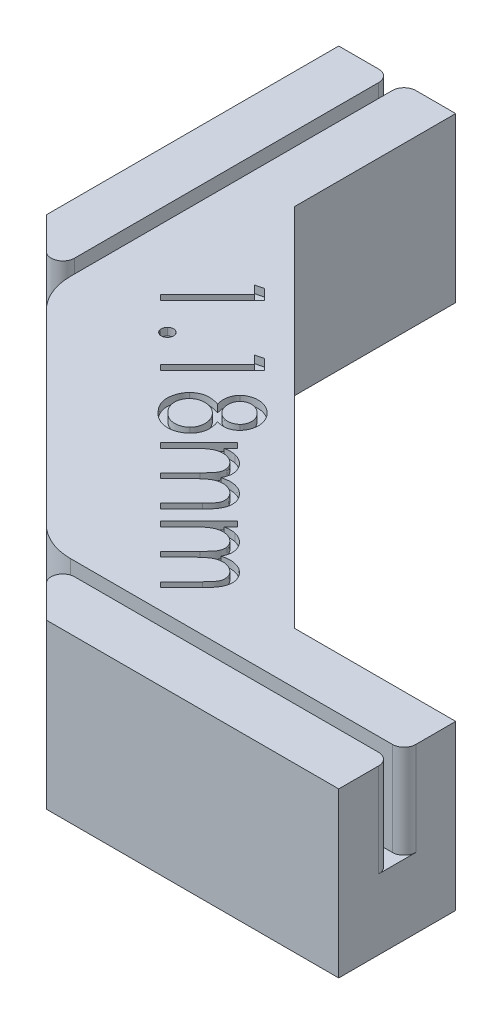
from build123d import *

# Parameters (mm, degrees)
BOSS_EXTRUDE1_DEPTH = 14
CUT_EXTRUDE1_DEPTH  = 8
CUT_EXTRUDE2_DEPTH  = 0.64
FILLET1_R           = 1
FILLET2_R           = 5


with BuildPart() as part:
    # Sketch1 → Boss-Extrude1 (new body)
    with BuildSketch(Plane(origin=(0, 0, 0), x_dir=(1, 0, 0), z_dir=(0, 1, 0))):
        Polygon((0, 30), (0, 55), (10, 55), (10, 41.213203436), (41.213203436, 10), (55, 10), (55, 0), (30, 0), align=None)
    extrude(amount=BOSS_EXTRUDE1_DEPTH)

    # Sketch2 → Cut-Extrude1 (cut)
    with BuildSketch(Plane(origin=(0, 14, 0), x_dir=(1, 0, 0), z_dir=(0, 1, 0))):
        Polygon((5.5875, 55), (5.5875, 5.5875), (55, 5.5875), (55, 4.4125), (4.4125, 4.4125), (4.4125, 55), align=None)
    extrude(amount=-CUT_EXTRUDE1_DEPTH, mode=Mode.SUBTRACT)

    # Sketch3 → Cut-Extrude2 (cut)
    # profile 1 of 6: a face of its own
    with BuildSketch(Plane(origin=(0, 14, 0), x_dir=(1, 0, 0), z_dir=(0, 1, 0))):
        Polygon((14.785653763, 33.874167542), (15.659541984, 33.000279321), (11.215050798, 28.555788135), (10.773654564, 28.997184369), (14.783109692, 33.006639498), (14.084762337, 33.704986853), align=None)
    # profile 2 of 6: a face of its own
    with BuildSketch(Plane(origin=(0, 14, 0), x_dir=(1, 0, 0), z_dir=(0, 1, 0))):
        with BuildLine():
            add(Edge.make_bspline(
                [(14.251767896, 26.849619916), (14.275302918, 26.823307617), (14.321148149, 26.772052367), (14.371597249, 26.681411104), (14.398423194, 26.582002855), (14.409202302, 26.477819656), (14.399147642, 26.373589218), (14.369306079, 26.273997821), (14.319069544, 26.181922935), (14.271989407, 26.129632863), (14.24795179, 26.10293522)],
                knots=[0, 0, 0, 0, 1.018590192, 1.984170814, 2.965801823, 3.975725526, 4.997849944, 5.971180134, 6.964149297, 8, 8, 8, 8], degree=3))
            add(Edge.make_bspline(
                [(14.24795179, 26.10293522), (14.221683464, 26.079292229), (14.170236504, 26.032987032), (14.078819379, 25.984128261), (13.979830846, 25.954061397), (13.875339869, 25.944942265), (13.770517381, 25.952387964), (13.672061254, 25.983219849), (13.579904284, 26.030190554), (13.528739435, 26.076617178), (13.50253913, 26.10039115)],
                knots=[0, 0, 0, 0, 1.021928092, 2.001463373, 2.977983146, 4.003457045, 5.027824197, 6.00434397, 6.978071908, 8, 8, 8, 8], degree=3))
            add(Edge.make_bspline(
                [(13.50253913, 26.10039115), (13.478765158, 26.126591455), (13.432338534, 26.177756304), (13.38536783, 26.269913274), (13.354535944, 26.3683694), (13.347090246, 26.473191889), (13.356209378, 26.577682866), (13.386276241, 26.676671399), (13.435135012, 26.768088523), (13.481440209, 26.819535483), (13.505083201, 26.84580381)],
                knots=[0, 0, 0, 0, 1.021928092, 1.99565603, 2.972175803, 3.996542955, 5.022016854, 5.998536627, 6.978071908, 8, 8, 8, 8], degree=3))
            add(Edge.make_bspline(
                [(13.505083201, 26.84580381), (13.531780843, 26.869841426), (13.584070915, 26.916921564), (13.676145802, 26.967158099), (13.775737198, 26.996999662), (13.879967636, 27.007054322), (13.984150836, 26.996275214), (14.083559084, 26.969449269), (14.174200347, 26.919000169), (14.225455597, 26.873154937), (14.251767896, 26.849619916)],
                knots=[0, 0, 0, 0, 1.035850703, 2.028819866, 3.002150056, 4.024274474, 5.034198177, 6.015829186, 6.981409808, 8, 8, 8, 8], degree=3))
        make_face()
    # profile 3 of 6: a face of its own
    with BuildSketch(Plane(origin=(0, 14, 0), x_dir=(1, 0, 0), z_dir=(0, 1, 0))):
        Polygon((19.966570756, 28.69325055), (20.840458977, 27.819362328), (16.395967791, 23.374871143), (15.954571557, 23.816267376), (19.964026685, 27.825722505), (19.26567933, 28.52406986), align=None)
    # profile 4 of 6: a face of its own
    with BuildSketch(Plane(origin=(0, 14, 0), x_dir=(1, 0, 0), z_dir=(0, 1, 0))):
        with BuildLine():
            add(Edge.make_bspline(
                [(22.647117982, 22.000704125), (22.665237377, 21.945796775), (22.700637121, 21.838524643), (22.740041783, 21.678296641), (22.772995926, 21.524960076), (22.794855482, 21.377092595), (22.805841438, 21.23515856), (22.809688639, 21.099115066), (22.800087591, 20.969432474), (22.782527702, 20.84524605), (22.755671004, 20.726134429), (22.719631145, 20.611000896), (22.675732613, 20.499204106), (22.621102657, 20.391941884), (22.560617258, 20.287105301), (22.489656213, 20.186487665), (22.411726682, 20.088125304), (22.352565593, 20.027701562), (22.322748992, 19.997248596)],
                knots=[0, 0, 0, 0, 1.287822378, 2.516010175, 3.674063788, 4.781691461, 5.843233308, 6.844856983, 7.810778634, 8.736691482, 9.637439608, 10.527922747, 11.42265571, 12.309925548, 13.20759656, 14.117022994, 15.05099826, 16, 16, 16, 16], degree=3))
            add(Edge.make_bspline(
                [(22.322748992, 19.997248596), (22.279815316, 19.956124111), (22.194716917, 19.874611688), (22.055176175, 19.768154134), (21.909768428, 19.674836004), (21.757821949, 19.594875675), (21.597797205, 19.532107066), (21.432311941, 19.480392015), (21.25968601, 19.444569415), (21.142015486, 19.432305895), (21.082514617, 19.426104766)],
                knots=[0, 0, 0, 0, 1.022008825, 2.025713258, 3.01306579, 3.991759542, 4.973709284, 5.965765121, 6.971375826, 8, 8, 8, 8], degree=3))
            add(Edge.make_bspline(
                [(21.082514617, 19.426104766), (21.008703742, 19.42298557), (20.862429889, 19.41680414), (20.643773049, 19.440157922), (20.429171747, 19.486630368), (20.218785678, 19.561635912), (20.01318925, 19.66321092), (19.811681958, 19.790370298), (19.612914524, 19.942066978), (19.489669493, 20.060014182), (19.426324713, 20.120636016)],
                knots=[0, 0, 0, 0, 0.954411477, 1.891393961, 2.83483847, 3.788855937, 4.772399019, 5.794968863, 6.866670633, 8, 8, 8, 8], degree=3))
            add(Edge.make_bspline(
                [(19.426324713, 20.120636016), (19.36815597, 20.181706618), (19.255027965, 20.300478233), (19.105248101, 20.487685897), (18.980888674, 20.678139748), (18.880922631, 20.870720415), (18.805156457, 21.065113784), (18.752936048, 21.261286658), (18.728055698, 21.4601594), (18.725564511, 21.658973525), (18.744648281, 21.853661467), (18.775652254, 22.041462), (18.822417242, 22.220122085), (18.885767933, 22.388523628), (18.960379796, 22.548988666), (19.051556213, 22.699588994), (19.156674018, 22.841622844), (19.23798803, 22.927117647), (19.278768623, 22.96999499)],
                knots=[0, 0, 0, 0, 1.266403576, 2.462932918, 3.595230427, 4.677622218, 5.716026896, 6.723182253, 7.718508806, 8.718470104, 9.703288732, 10.652924589, 11.575150168, 12.471866133, 13.352171177, 14.229221933, 15.111919616, 16, 16, 16, 16], degree=3))
            add(Edge.make_bspline(
                [(19.278768623, 22.96999499), (19.310186905, 23.000096834), (19.372073268, 23.059390135), (19.470740286, 23.140288302), (19.573819083, 23.211565178), (19.681067247, 23.2734848), (19.790918506, 23.329271087), (19.905543386, 23.374873307), (20.024390214, 23.411378048), (20.146890016, 23.441665379), (20.275121575, 23.459962394), (20.408975442, 23.47091996), (20.549765849, 23.468724715), (20.696332105, 23.457316812), (20.849378825, 23.435580032), (21.007763663, 23.401394391), (21.17382754, 23.360415692), (21.284972852, 23.32433037), (21.342009809, 23.305812298)],
                knots=[0, 0, 0, 0, 0.941646764, 1.854814777, 2.758663323, 3.651256701, 4.533788624, 5.42349862, 6.317647985, 7.223730787, 8.151860389, 9.118407791, 10.128096724, 11.196015397, 12.299359275, 13.471241831, 14.702305393, 16, 16, 16, 16], degree=3))
            add(Edge.make_bspline(
                [(21.342009809, 23.305812298), (21.318685615, 23.386322718), (21.273658879, 23.541745944), (21.24260122, 23.776297788), (21.238338514, 23.999968904), (21.266945425, 24.213190557), (21.322486634, 24.413296093), (21.405021466, 24.598638522), (21.51169017, 24.768986789), (21.602006934, 24.867038657), (21.64729827, 24.916208932)],
                knots=[0, 0, 0, 0, 1.163026674, 2.245192069, 3.276123062, 4.262521083, 5.22298603, 6.15124475, 7.072900833, 8, 8, 8, 8], degree=3))
            add(Edge.make_bspline(
                [(21.64729827, 24.916208932), (21.697675779, 24.962455372), (21.798679069, 25.055176164), (21.976845579, 25.164403364), (22.172999544, 25.251734696), (22.387146321, 25.312788662), (22.611792857, 25.348726552), (22.84205945, 25.353989056), (23.074019514, 25.326799656), (23.304681513, 25.267289397), (23.530292904, 25.18196882), (23.744172537, 25.067548151), (23.944709046, 24.927004138), (24.064575233, 24.815097201), (24.12522295, 24.758476561)],
                knots=[0, 0, 0, 0, 0.893644292, 1.791692663, 2.721245645, 3.698154088, 4.69853899, 5.692571982, 6.704201475, 7.746416452, 8.804306481, 9.854916457, 10.914669584, 12, 12, 12, 12], degree=3))
            add(Edge.make_bspline(
                [(24.12522295, 24.758476561), (24.180250678, 24.699590126), (24.288827359, 24.583399731), (24.423004607, 24.38683578), (24.532341872, 24.177968153), (24.610830688, 23.956561739), (24.665974305, 23.731214945), (24.687001782, 23.503821346), (24.679892844, 23.27798423), (24.641659475, 23.056389371), (24.575542384, 22.845144784), (24.486380304, 22.647454348), (24.370357136, 22.46773464), (24.274740709, 22.363259891), (24.22698577, 22.311080727)],
                knots=[0, 0, 0, 0, 1.066800828, 2.104933201, 3.142943896, 4.182839012, 5.210561903, 6.209775075, 7.199366311, 8.197108877, 9.179992245, 10.12547414, 11.063781507, 12, 12, 12, 12], degree=3))
            add(Edge.make_bspline(
                [(24.22698577, 22.311080727), (24.176071579, 22.264204855), (24.075955858, 22.172029932), (23.905983209, 22.061132598), (23.723346557, 21.981212971), (23.530043295, 21.925978069), (23.324465716, 21.903475743), (23.107796849, 21.905828309), (22.879497572, 21.938859631), (22.726463486, 21.979587457), (22.647117982, 22.000704125)],
                knots=[0, 0, 0, 0, 0.976858676, 1.920857554, 2.851700144, 3.785065739, 4.750519099, 5.763235174, 6.840276451, 8, 8, 8, 8], degree=3))
        make_face()
        with BuildLine():
            add(Edge.make_bspline(
                [(23.671106363, 24.347609173), (23.640667893, 24.377026718), (23.581114901, 24.434582263), (23.484681118, 24.509478923), (23.386772706, 24.575499337), (23.28440855, 24.628638872), (23.179757521, 24.672168126), (23.072600569, 24.705782572), (22.962070279, 24.727219251), (22.850079856, 24.738452367), (22.738953864, 24.739896321), (22.631563528, 24.731177771), (22.529210947, 24.71213306), (22.43187039, 24.682869537), (22.339470223, 24.642814207), (22.25162229, 24.593565195), (22.169143992, 24.532862616), (22.119184534, 24.48594673), (22.093782645, 24.462092346)],
                knots=[0, 0, 0, 0, 1.153345825, 2.256525798, 3.324245021, 4.368806591, 5.395038832, 6.411588186, 7.425043215, 8.459189127, 9.476592696, 10.451053976, 11.392023347, 12.309986167, 13.216226714, 14.132513687, 15.050476507, 16, 16, 16, 16], degree=3))
            add(Edge.make_bspline(
                [(22.093782645, 24.462092346), (22.070372419, 24.436665419), (22.023912761, 24.386203439), (21.963284482, 24.302694058), (21.913624791, 24.211955172), (21.874651871, 24.114747765), (21.843270355, 24.011942409), (21.82351662, 23.902672035), (21.813313459, 23.786868056), (21.813641036, 23.666868555), (21.823311316, 23.54594525), (21.844125744, 23.428642696), (21.872850781, 23.315378462), (21.913981961, 23.207339632), (21.964886773, 23.103680471), (22.026580756, 23.005839144), (22.096688495, 22.911319496), (22.151232342, 22.854114724), (22.179009008, 22.824982971)],
                knots=[0, 0, 0, 0, 0.91734365, 1.820549368, 2.732695169, 3.656923812, 4.597403426, 5.58239753, 6.599811386, 7.6807907, 8.765516921, 9.817005095, 10.841188329, 11.863884905, 12.881111811, 13.90281608, 14.932000932, 16, 16, 16, 16], degree=3))
            add(Edge.make_bspline(
                [(22.179009008, 22.824982971), (22.21672372, 22.789997031), (22.291647526, 22.720494187), (22.419313686, 22.635271695), (22.556705627, 22.565685714), (22.703381935, 22.514074414), (22.855092102, 22.480976857), (23.007750835, 22.468037574), (23.159850527, 22.475247664), (23.308185045, 22.505421744), (23.450322293, 22.550172985), (23.579993699, 22.611440264), (23.697305073, 22.685329385), (23.763942337, 22.746343074), (23.797037854, 22.776645631)],
                knots=[0, 0, 0, 0, 1.033201928, 2.052552341, 3.074574245, 4.123699385, 5.170708477, 6.189024034, 7.196535734, 8.221683312, 9.224855385, 10.18612672, 11.0991366, 12, 12, 12, 12], degree=3))
            add(Edge.make_bspline(
                [(23.797037854, 22.776645631), (23.818870504, 22.799438296), (23.862385124, 22.844866319), (23.91611246, 22.922093161), (23.964209613, 23.002881556), (24.003979652, 23.089721644), (24.033606563, 23.182629381), (24.057431151, 23.280264617), (24.070512337, 23.383487458), (24.077239135, 23.49099412), (24.07440682, 23.601211235), (24.055790099, 23.711254177), (24.025176187, 23.820649554), (23.980077691, 23.928712016), (23.922397441, 24.035944679), (23.851988579, 24.142176184), (23.767313834, 24.246624107), (23.703813437, 24.313277889), (23.671106363, 24.347609173)],
                knots=[0, 0, 0, 0, 0.859224433, 1.712518804, 2.557077351, 3.420954658, 4.30923577, 5.212064549, 6.156981658, 7.141240852, 8.147518387, 9.154725018, 10.175701212, 11.238298814, 12.339856676, 13.490829141, 14.707604363, 16, 16, 16, 16], degree=3))
        make_face(mode=Mode.SUBTRACT)
        with BuildLine():
            add(Edge.make_bspline(
                [(21.783406043, 22.416659654), (21.745067904, 22.453466815), (21.66962977, 22.525892437), (21.546770695, 22.619664244), (21.420337578, 22.700850275), (21.288615203, 22.767313966), (21.151823758, 22.819805643), (21.010271357, 22.857876191), (20.864137807, 22.882366439), (20.715483297, 22.891664553), (20.567697965, 22.890110139), (20.424780058, 22.872791036), (20.288255543, 22.845527907), (20.158384553, 22.804664385), (20.035699424, 22.749532108), (19.919948616, 22.681357297), (19.808774982, 22.603137525), (19.743150257, 22.540100334), (19.709988575, 22.508246192)],
                knots=[0, 0, 0, 0, 1.105778885, 2.175846255, 3.211793481, 4.230405104, 5.241991603, 6.257077546, 7.277371057, 8.321486389, 9.354533115, 10.34992635, 11.314300325, 12.249628111, 13.178265938, 14.107952245, 15.043904763, 16, 16, 16, 16], degree=3))
            add(Edge.make_bspline(
                [(19.709988575, 22.508246192), (19.671376513, 22.466465423), (19.594229928, 22.382987785), (19.501653615, 22.238710319), (19.42815601, 22.081822954), (19.376744164, 21.913498603), (19.34713024, 21.738628291), (19.342829971, 21.560244974), (19.367036717, 21.381508354), (19.413921527, 21.202504741), (19.487238486, 21.026531861), (19.585096017, 20.855234168), (19.706431535, 20.688482161), (19.802916073, 20.586441), (19.852456524, 20.534047474)],
                knots=[0, 0, 0, 0, 0.924030296, 1.846205005, 2.775062971, 3.73508078, 4.700116031, 5.652245842, 6.625895568, 7.624752618, 8.654661343, 9.717290307, 10.827931717, 12, 12, 12, 12], degree=3))
            add(Edge.make_bspline(
                [(19.852456524, 20.534047474), (19.892925737, 20.495137406), (19.971512217, 20.419578603), (20.097970046, 20.320993153), (20.22575447, 20.236196649), (20.358087802, 20.168862422), (20.492245097, 20.114302892), (20.629755125, 20.07642103), (20.770004912, 20.052992528), (20.911640077, 20.045776712), (21.051631796, 20.052561723), (21.187224278, 20.069646674), (21.316238953, 20.100536832), (21.439244494, 20.142901408), (21.557004481, 20.195990552), (21.66775194, 20.262943437), (21.773549841, 20.340759417), (21.83745041, 20.401457243), (21.86990444, 20.432284654)],
                knots=[0, 0, 0, 0, 1.192905526, 2.316483069, 3.404188558, 4.448474118, 5.467989243, 6.478496282, 7.474461727, 8.485611991, 9.487313933, 10.451223935, 11.387112887, 12.302277834, 13.214017268, 14.127760184, 15.049120709, 16, 16, 16, 16], degree=3))
            add(Edge.make_bspline(
                [(21.86990444, 20.432284654), (21.899415267, 20.463930432), (21.957924547, 20.526672546), (22.033166473, 20.630301739), (22.095987701, 20.740899854), (22.147474724, 20.858381051), (22.1847459, 20.983313934), (22.212350766, 21.114289265), (22.22542115, 21.252430767), (22.228256593, 21.395373124), (22.218079255, 21.539689893), (22.195614679, 21.680762521), (22.159313699, 21.816922033), (22.111642663, 21.948287581), (22.048362982, 22.073599855), (21.972450443, 22.193667839), (21.885441889, 22.310047464), (21.817669933, 22.380859016), (21.783406043, 22.416659654)],
                knots=[0, 0, 0, 0, 0.944058104, 1.871725224, 2.788006072, 3.716688801, 4.665455454, 5.629499403, 6.634454943, 7.68994399, 8.747865978, 9.788843788, 10.803769579, 11.820087617, 12.834379937, 13.861768024, 14.918960718, 16, 16, 16, 16], degree=3))
        make_face(mode=Mode.SUBTRACT)
    # profile 5 of 6: a face of its own
    with BuildSketch(Plane(origin=(0, 14, 0), x_dir=(1, 0, 0), z_dir=(0, 1, 0))):
        with BuildLine():
            Line((25.04018524, 21.304531899), (25.459956875, 20.884760264))
            Line((25.459956875, 20.884760264), (24.89262915, 20.31743254))
            add(Edge.make_bspline(
                [(24.89262915, 20.31743254), (24.978534593, 20.330861693), (25.14294442, 20.356563032), (25.382207878, 20.368930539), (25.602287599, 20.36175126), (25.740013228, 20.335221847), (25.805950464, 20.322520681)],
                knots=[0, 0, 0, 0, 1.134473677, 2.171208445, 3.124451552, 4, 4, 4, 4], degree=3))
            add(Edge.make_bspline(
                [(25.805950464, 20.322520681), (25.889037106, 20.298947898), (26.052365129, 20.252609571), (26.280326349, 20.144493615), (26.49048814, 20.011159061), (26.611439771, 19.899208107), (26.672206474, 19.842963389)],
                knots=[0, 0, 0, 0, 1.032654138, 2.029945562, 3.010234824, 4, 4, 4, 4], degree=3))
            add(Edge.make_bspline(
                [(26.672206474, 19.842963389), (26.710429476, 19.802616132), (26.786653113, 19.722156346), (26.884088688, 19.588320108), (26.966253458, 19.445626593), (27.032685452, 19.296577127), (27.085295676, 19.144836278), (27.119908431, 18.992977393), (27.136864378, 18.843186452), (27.135722434, 18.693224329), (27.114532259, 18.53807389), (27.07068983, 18.373706416), (27.008935176, 18.195998814), (26.952426479, 18.077290665), (26.92279742, 18.015048726)],
                knots=[0, 0, 0, 0, 1.00533737, 2.004826032, 2.988358455, 3.981311445, 4.95472706, 5.891402496, 6.795035451, 7.67782268, 8.599500702, 9.621607202, 10.752943411, 12, 12, 12, 12], degree=3))
            add(Edge.make_bspline(
                [(26.92279742, 18.015048726), (26.972279071, 18.02867998), (27.069387072, 18.05543139), (27.215336596, 18.08670725), (27.358728671, 18.105986022), (27.499576997, 18.120065329), (27.638161396, 18.121849781), (27.774262899, 18.116409735), (27.907494319, 18.098741312), (28.080701161, 18.067626778), (28.288462349, 18.006310073), (28.521656474, 17.900675214), (28.737379922, 17.76503673), (28.861368839, 17.649534185), (28.923708878, 17.591460985)],
                knots=[0, 0, 0, 0, 0.859045316, 1.685880955, 2.495883023, 3.279812829, 4.053556047, 4.813802993, 5.557673419, 6.301035794, 7.758555751, 9.168861684, 10.576539933, 12, 12, 12, 12], degree=3))
            add(Edge.make_bspline(
                [(28.923708878, 17.591460985), (28.97717966, 17.533949644), (29.081569297, 17.421671725), (29.206460181, 17.231573725), (29.299301163, 17.030037894), (29.35874187, 16.817880535), (29.38745007, 16.600592896), (29.380900991, 16.38070973), (29.338874751, 16.161467857), (29.277157572, 15.979519245), (29.208613358, 15.831961383), (29.141652512, 15.715253337), (29.062290819, 15.592516885), (28.969005786, 15.464108205), (28.862170219, 15.329853046), (28.74238181, 15.18958739), (28.608303677, 15.044460771), (28.512700266, 14.947474169), (28.463232115, 14.897290312)],
                knots=[0, 0, 0, 0, 1.209733365, 2.361731451, 3.491510003, 4.620000237, 5.74773195, 6.860184626, 7.998113719, 9.179214519, 9.814231796, 10.505477689, 11.252986731, 12.068123698, 12.952781798, 13.899218811, 14.912991071, 16, 16, 16, 16], degree=3))
            Line((28.463232115, 14.897290312), (26.668390368, 13.102448565))
            Line((26.668390368, 13.102448565), (26.237170416, 13.533668517))
            Line((26.237170416, 13.533668517), (28.032012163, 15.328510264))
            add(Edge.make_bspline(
                [(28.032012163, 15.328510264), (28.074101271, 15.37122351), (28.15471436, 15.453032007), (28.268556211, 15.572121705), (28.367783895, 15.684890002), (28.455976063, 15.788576922), (28.530816175, 15.885121076), (28.593912288, 15.972936379), (28.644110585, 16.053011404), (28.693263687, 16.148931285), (28.73471976, 16.267382307), (28.764325779, 16.411310608), (28.765291617, 16.559654041), (28.746468388, 16.709117732), (28.705269148, 16.858917934), (28.635324001, 17.002180511), (28.545610059, 17.14193085), (28.467674068, 17.223759962), (28.427615128, 17.26581996)],
                knots=[0, 0, 0, 0, 1.264308701, 2.421525023, 3.47275104, 4.430787231, 5.290892379, 6.047435303, 6.709808252, 7.281521255, 8.316428011, 9.345565774, 10.364833074, 11.42819055, 12.514927032, 13.622603783, 14.778023183, 16, 16, 16, 16], degree=3))
            add(Edge.make_bspline(
                [(28.427615128, 17.26581996), (28.375317763, 17.314454339), (28.271877919, 17.410649102), (28.089508158, 17.519784886), (27.893328487, 17.603128393), (27.682441476, 17.651867107), (27.465986404, 17.674877843), (27.248481674, 17.662781235), (27.033425806, 17.618728173), (26.855805691, 17.555032885), (26.711623598, 17.482162072), (26.592586752, 17.411901823), (26.466268439, 17.323227178), (26.329699378, 17.219647415), (26.183630059, 17.100592944), (26.030329939, 16.963127719), (25.865266882, 16.812739934), (25.75588752, 16.703206697), (25.699099503, 16.64633879)],
                knots=[0, 0, 0, 0, 1.07879147, 2.133759908, 3.19862743, 4.294988807, 5.398359592, 6.485013952, 7.579286357, 8.712627368, 9.329994089, 10.023738666, 10.80383394, 11.665515132, 12.619194427, 13.656309143, 14.783193149, 16, 16, 16, 16], degree=3))
            Line((25.699099503, 16.64633879), (24.411799823, 15.35903911))
            Line((24.411799823, 15.35903911), (23.992028189, 15.778810745))
            Line((23.992028189, 15.778810745), (25.674930833, 17.461713389))
            add(Edge.make_bspline(
                [(25.674930833, 17.461713389), (25.722135568, 17.509490529), (25.812973521, 17.601429982), (25.941041339, 17.735469429), (26.054567117, 17.859933761), (26.152963322, 17.975258916), (26.238252678, 18.079789724), (26.30892505, 18.175618148), (26.365097796, 18.26179204), (26.421425425, 18.362628652), (26.468969349, 18.486229793), (26.505484401, 18.635975192), (26.511409956, 18.790033191), (26.497216379, 18.945076288), (26.455665853, 19.098275178), (26.390624479, 19.246004326), (26.298513126, 19.385381758), (26.221876339, 19.468319209), (26.1824729, 19.510962187)],
                knots=[0, 0, 0, 0, 1.330253238, 2.559859307, 3.671624332, 4.666336319, 5.56214849, 6.34322225, 7.023421132, 7.598495632, 8.627775355, 9.636183871, 10.636834068, 11.666353592, 12.709349255, 13.765849434, 14.851292963, 16, 16, 16, 16], degree=3))
            add(Edge.make_bspline(
                [(26.1824729, 19.510962187), (26.132038739, 19.556690257), (26.031583232, 19.647772102), (25.85681307, 19.755874707), (25.663963087, 19.83445118), (25.457496979, 19.886211537), (25.243433512, 19.908939457), (25.026857637, 19.902000293), (24.811869172, 19.860084924), (24.634589381, 19.799331329), (24.491416411, 19.731906875), (24.376863394, 19.666466093), (24.256507237, 19.586946246), (24.128575153, 19.495745421), (23.997127649, 19.387865208), (23.858466259, 19.268233936), (23.712601195, 19.135853673), (23.615990912, 19.040264719), (23.565896378, 18.990699767)],
                knots=[0, 0, 0, 0, 1.083894396, 2.158916845, 3.256307527, 4.392703367, 5.541800114, 6.678397068, 7.834691665, 9.021364541, 9.656516682, 10.355927896, 11.122923385, 11.956054792, 12.859926905, 13.833085992, 14.876407946, 16, 16, 16, 16], degree=3))
            Line((23.565896378, 18.990699767), (22.173017772, 17.597821162))
            Line((22.173017772, 17.597821162), (21.753246137, 18.017592796))
            Line((21.753246137, 18.017592796), (25.04018524, 21.304531899))
        make_face()
    # profile 6 of 6: a face of its own
    with BuildSketch(Plane(origin=(0, 14, 0), x_dir=(1, 0, 0), z_dir=(0, 1, 0))):
        with BuildLine():
            Line((30.854325421, 15.490391718), (31.274097056, 15.070620083))
            Line((31.274097056, 15.070620083), (30.706769331, 14.503292359))
            add(Edge.make_bspline(
                [(30.706769331, 14.503292359), (30.792674774, 14.516721512), (30.957084601, 14.542422851), (31.196348059, 14.554790358), (31.41642778, 14.547611079), (31.554153409, 14.521081666), (31.620090645, 14.5083805)],
                knots=[0, 0, 0, 0, 1.134473677, 2.171208445, 3.124451552, 4, 4, 4, 4], degree=3))
            add(Edge.make_bspline(
                [(31.620090645, 14.5083805), (31.703177287, 14.484807717), (31.86650531, 14.43846939), (32.09446653, 14.330353434), (32.304628321, 14.19701888), (32.425579952, 14.085067926), (32.486346655, 14.028823208)],
                knots=[0, 0, 0, 0, 1.032654138, 2.029945562, 3.010234824, 4, 4, 4, 4], degree=3))
            add(Edge.make_bspline(
                [(32.486346655, 14.028823208), (32.524569657, 13.988475951), (32.600793294, 13.908016165), (32.698228869, 13.774179927), (32.780393639, 13.631486412), (32.846825633, 13.482436946), (32.899435857, 13.330696097), (32.934048612, 13.178837212), (32.951004559, 13.029046271), (32.949862615, 12.879084148), (32.92867244, 12.723933709), (32.884830011, 12.559566235), (32.823075357, 12.381858633), (32.76656666, 12.263150484), (32.7369376, 12.200908545)],
                knots=[0, 0, 0, 0, 1.00533737, 2.004826032, 2.988358455, 3.981311445, 4.95472706, 5.891402496, 6.795035451, 7.67782268, 8.599500702, 9.621607202, 10.752943411, 12, 12, 12, 12], degree=3))
            add(Edge.make_bspline(
                [(32.7369376, 12.200908545), (32.786419252, 12.214539799), (32.883527253, 12.241291209), (33.029476777, 12.272567069), (33.172868852, 12.291845841), (33.313717178, 12.305925148), (33.452301577, 12.307709601), (33.58840308, 12.302269554), (33.7216345, 12.284601131), (33.894841342, 12.253486597), (34.10260253, 12.192169892), (34.335796655, 12.086535033), (34.551520103, 11.950896549), (34.67550902, 11.835394004), (34.737849059, 11.777320804)],
                knots=[0, 0, 0, 0, 0.859045316, 1.685880955, 2.495883023, 3.279812829, 4.053556047, 4.813802993, 5.557673419, 6.301035794, 7.758555751, 9.168861684, 10.576539933, 12, 12, 12, 12], degree=3))
            add(Edge.make_bspline(
                [(34.737849059, 11.777320804), (34.791319841, 11.719809463), (34.895709478, 11.607531545), (35.020600361, 11.417433544), (35.113441344, 11.215897713), (35.172882051, 11.003740354), (35.201590251, 10.786452715), (35.195041172, 10.566569549), (35.153014932, 10.347327677), (35.091297753, 10.165379064), (35.022753539, 10.017821202), (34.955792693, 9.901113156), (34.876431, 9.778376704), (34.783145967, 9.649968024), (34.6763104, 9.515712865), (34.556521991, 9.375447209), (34.422443857, 9.23032059), (34.326840447, 9.133333988), (34.277372296, 9.083150131)],
                knots=[0, 0, 0, 0, 1.209733365, 2.361731451, 3.491510003, 4.620000237, 5.74773195, 6.860184626, 7.998113719, 9.179214519, 9.814231796, 10.505477689, 11.252986731, 12.068123698, 12.952781798, 13.899218811, 14.912991071, 16, 16, 16, 16], degree=3))
            Line((34.277372296, 9.083150131), (32.482530549, 7.288308384))
            Line((32.482530549, 7.288308384), (32.051310597, 7.719528336))
            Line((32.051310597, 7.719528336), (33.846152344, 9.514370083))
            add(Edge.make_bspline(
                [(33.846152344, 9.514370083), (33.888241452, 9.557083329), (33.968854541, 9.638891826), (34.082696392, 9.757981524), (34.181924076, 9.870749821), (34.270116244, 9.974436741), (34.344956356, 10.070980895), (34.408052468, 10.158796198), (34.458250766, 10.238871223), (34.507403868, 10.334791104), (34.548859941, 10.453242126), (34.57846596, 10.597170427), (34.579431798, 10.74551386), (34.560608569, 10.894977551), (34.519409329, 11.044777753), (34.449464182, 11.18804033), (34.35975024, 11.327790669), (34.281814249, 11.409619781), (34.241755309, 11.451679779)],
                knots=[0, 0, 0, 0, 1.264308701, 2.421525023, 3.47275104, 4.430787231, 5.290892379, 6.047435303, 6.709808252, 7.281521255, 8.316428011, 9.345565774, 10.364833074, 11.42819055, 12.514927032, 13.622603783, 14.778023183, 16, 16, 16, 16], degree=3))
            add(Edge.make_bspline(
                [(34.241755309, 11.451679779), (34.189457944, 11.500314158), (34.0860181, 11.596508921), (33.903648339, 11.705644705), (33.707468668, 11.788988212), (33.496581657, 11.837726926), (33.280126585, 11.860737662), (33.062621855, 11.848641054), (32.847565987, 11.804587992), (32.669945872, 11.740892704), (32.525763779, 11.668021891), (32.406726933, 11.597761642), (32.28040862, 11.509086997), (32.143839559, 11.405507234), (31.99777024, 11.286452763), (31.84447012, 11.148987538), (31.679407063, 10.998599753), (31.570027701, 10.889066516), (31.513239684, 10.832198609)],
                knots=[0, 0, 0, 0, 1.07879147, 2.133759908, 3.19862743, 4.294988807, 5.398359592, 6.485013952, 7.579286357, 8.712627368, 9.329994089, 10.023738666, 10.80383394, 11.665515132, 12.619194427, 13.656309143, 14.783193149, 16, 16, 16, 16], degree=3))
            Line((31.513239684, 10.832198609), (30.225940004, 9.544898929))
            Line((30.225940004, 9.544898929), (29.80616837, 9.964670564))
            Line((29.80616837, 9.964670564), (31.489071014, 11.647573208))
            add(Edge.make_bspline(
                [(31.489071014, 11.647573208), (31.536275749, 11.695350348), (31.627113702, 11.787289801), (31.75518152, 11.921329248), (31.868707298, 12.04579358), (31.967103503, 12.161118736), (32.052392859, 12.265649543), (32.123065231, 12.361477967), (32.179237977, 12.447651859), (32.235565606, 12.548488471), (32.28310953, 12.672089612), (32.319624582, 12.821835011), (32.325550137, 12.97589301), (32.311356559, 13.130936108), (32.269806034, 13.284134997), (32.20476466, 13.431864146), (32.112653307, 13.571241577), (32.03601652, 13.654179028), (31.996613081, 13.696822006)],
                knots=[0, 0, 0, 0, 1.330253238, 2.559859307, 3.671624332, 4.666336319, 5.56214849, 6.34322225, 7.023421132, 7.598495632, 8.627775355, 9.636183871, 10.636834068, 11.666353592, 12.709349255, 13.765849434, 14.851292963, 16, 16, 16, 16], degree=3))
            add(Edge.make_bspline(
                [(31.996613081, 13.696822006), (31.94617892, 13.742550077), (31.845723413, 13.833631921), (31.670953251, 13.941734526), (31.478103268, 14.020310999), (31.27163716, 14.072071356), (31.057573693, 14.094799276), (30.840997818, 14.087860112), (30.626009353, 14.045944743), (30.448729562, 13.985191148), (30.305556592, 13.917766694), (30.191003575, 13.852325912), (30.070647418, 13.772806065), (29.942715334, 13.68160524), (29.81126783, 13.573725027), (29.67260644, 13.454093755), (29.526741376, 13.321713492), (29.430131092, 13.226124538), (29.380036559, 13.176559586)],
                knots=[0, 0, 0, 0, 1.083894396, 2.158916845, 3.256307527, 4.392703367, 5.541800114, 6.678397068, 7.834691665, 9.021364541, 9.656516682, 10.355927896, 11.122923385, 11.956054792, 12.859926905, 13.833085992, 14.876407946, 16, 16, 16, 16], degree=3))
            Line((29.380036559, 13.176559586), (27.987157953, 11.783680981))
            Line((27.987157953, 11.783680981), (27.567386318, 12.203452615))
            Line((27.567386318, 12.203452615), (30.854325421, 15.490391718))
        make_face()
    extrude(amount=-CUT_EXTRUDE2_DEPTH, mode=Mode.SUBTRACT)

    # Fillet1
    fillet1_edges = [part.edges().sort_by_distance(p)[0] for p in [
        (5.5875, 10, -55),
        (25.5875, 10, -4.4125),
        (55, 10, -4.4125),
        (4.4125, 10, -25.5875),
        (4.4125, 10, -55),
        (55, 10, -5.5875),
    ]]
    fillet(fillet1_edges, radius=FILLET1_R)

    # Fillet2
    fillet2_edges = [part.edges().sort_by_distance(p)[0] for p in [
        (5.5875, 10, -24.4125),
        (24.4125, 10, -5.5875),
    ]]
    fillet(fillet2_edges, radius=FILLET2_R)


solid = part.part
